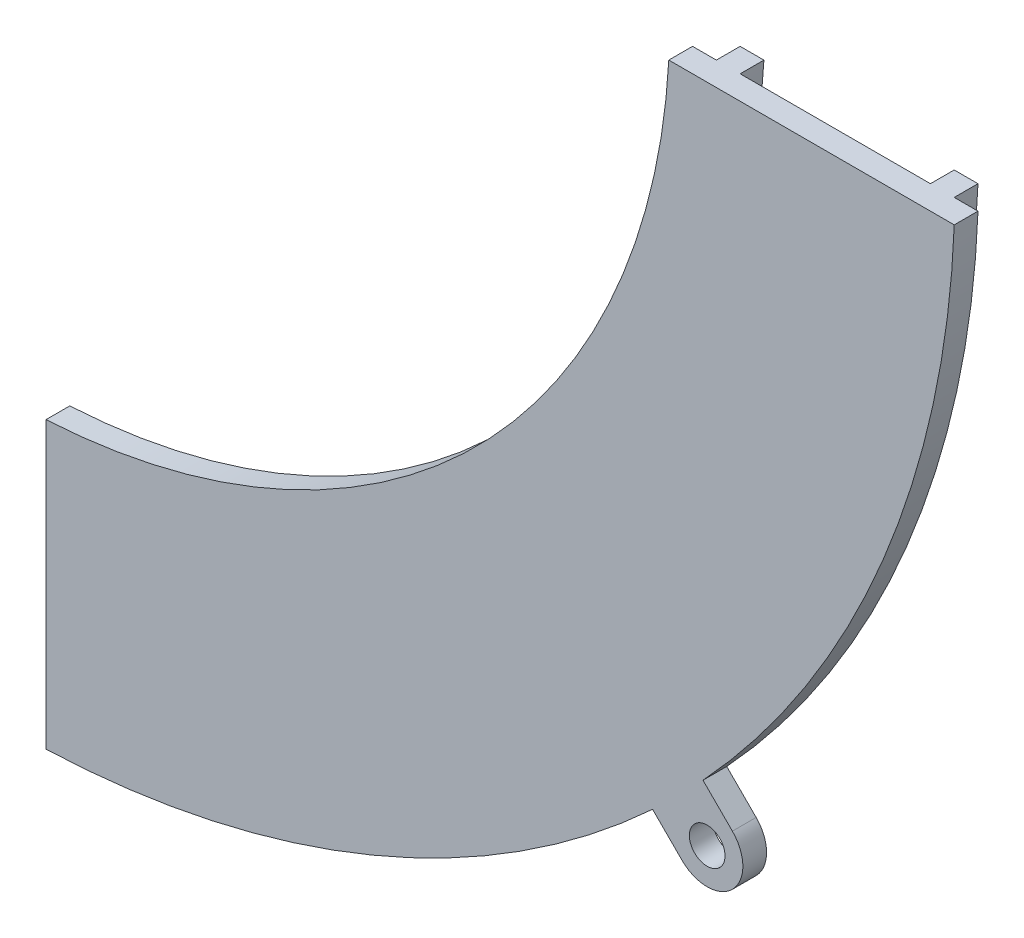
from build123d import *

# Parameters (mm, degrees)
EXTRUDE_1_DEPTH = 2
EXTRUDE_2_DEPTH = 2
EXTRUDE_START   = -2
SKETCH_4_R      = 1.5
EXTRUDE_3_DEPTH = 2


with BuildPart() as part:
    # 草图2 → 凸台-拉伸1 (new body)
    with BuildSketch(Plane.XY):
        with BuildLine():
            Line((3, -77.441913716), (3, -79.443376061))
            ThreePointArc((3, -79.443376061), (56.214989104, -56.214989104), (79.443376061, -3))
            Line((79.443376061, -3), (77.441913716, -3))
            Line((77.441913716, -3), (55.418859606, -3))
            ThreePointArc((55.418859606, -3), (39.244426356, -39.244426356), (3, -55.418859606))
            Line((3, -55.418859606), (3, -77.441913716))
        make_face()
    extrude(amount=EXTRUDE_1_DEPTH)

    # 草图3 → 凸台-拉伸2 (add)
    with BuildSketch(Plane.XY):
        with BuildLine():
            Line((3, -57.421685799), (3, -59.42432162))
            ThreePointArc((3, -59.42432162), (42.072853481, -42.072853481), (59.42432162, -3))
            Line((59.42432162, -3), (57.421685799, -3))
            ThreePointArc((57.421685799, -3), (40.658639918, -40.658639918), (3, -57.421685799))
        make_face()
        with BuildLine():
            Line((77.441913716, -3), (75.440373806, -3))
            ThreePointArc((75.440373806, -3), (53.38656198, -53.38656198), (3, -75.440373806))
            Line((3, -75.440373806), (3, -77.441913716))
            ThreePointArc((3, -77.441913716), (54.800775542, -54.800775542), (77.441913716, -3))
        make_face()
    extrude(amount=-EXTRUDE_2_DEPTH)

    # 草图4 → 凸台-拉伸3 (add)
    with BuildSketch(Plane.XY.offset(2).offset(EXTRUDE_START)):
        with BuildLine():
            ThreePointArc((58.296270277, -54.05362959), (56.214989104, -56.214989104), (54.05362959, -58.296270277))
            Line((54.05362959, -58.296270277), (56.528503324, -60.771144011))
            ThreePointArc((56.528503324, -60.771144011), (60.771144011, -60.771144011), (60.771144011, -56.528503324))
            Line((60.771144011, -56.528503324), (58.296270277, -54.05362959))
        make_face()
        with Locations((58.649823667, -58.649823667)):
            Circle(SKETCH_4_R, mode=Mode.SUBTRACT)
    extrude(amount=EXTRUDE_3_DEPTH)


solid = part.part
